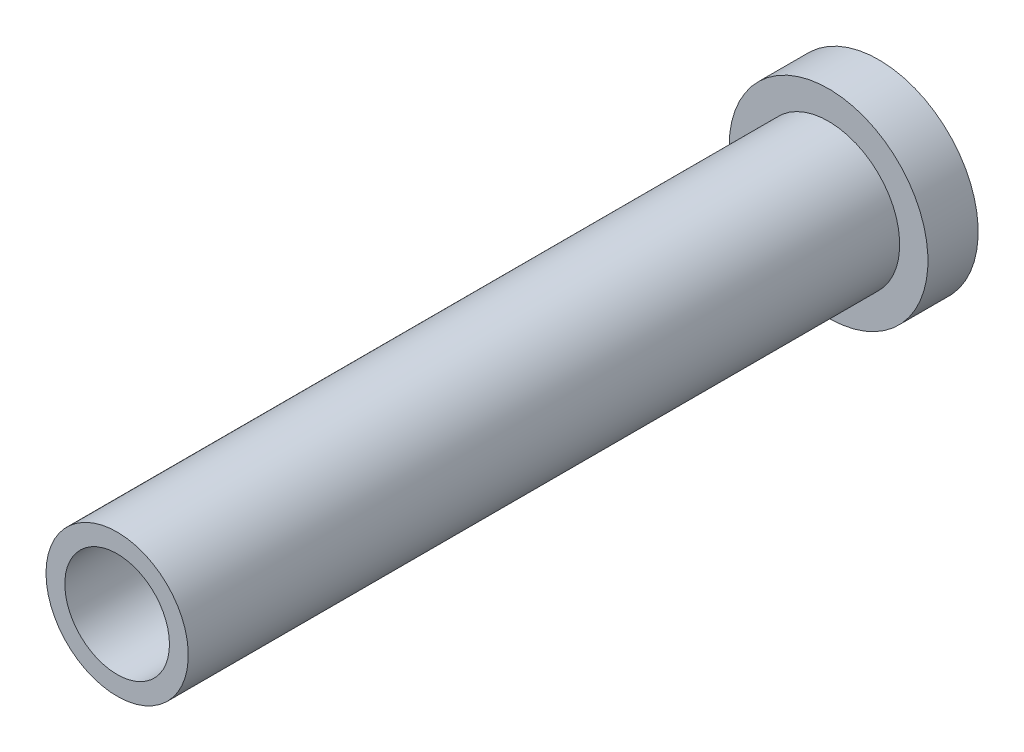
from build123d import *

# Parameters (mm, degrees)
SKETCH_1_R          = 4.75
EXTRUDE_1_DEPTH     = 2.4
SKETCH_2_R          = 3.4
EXTRUDE_2_DEPTH     = 34
SKETCH_3_R          = 2.5
CUT_EXTRUDE_1_DEPTH = 5.4


with BuildPart() as part:
    # 草图1 → 凸台-拉伸1 (new body)
    with BuildSketch(Plane.XY):
        Circle(SKETCH_1_R)
    extrude(amount=EXTRUDE_1_DEPTH)

    # 草图2 → 凸台-拉伸2 (add)
    with BuildSketch(Plane.XY.offset(2.4)):
        Circle(SKETCH_2_R)
    extrude(amount=EXTRUDE_2_DEPTH)

    # 草图3 → 切除-拉伸1 (cut)
    with BuildSketch(Plane.XY.offset(36.4)):
        Circle(SKETCH_3_R)
    extrude(amount=-CUT_EXTRUDE_1_DEPTH, mode=Mode.SUBTRACT)


solid = part.part
